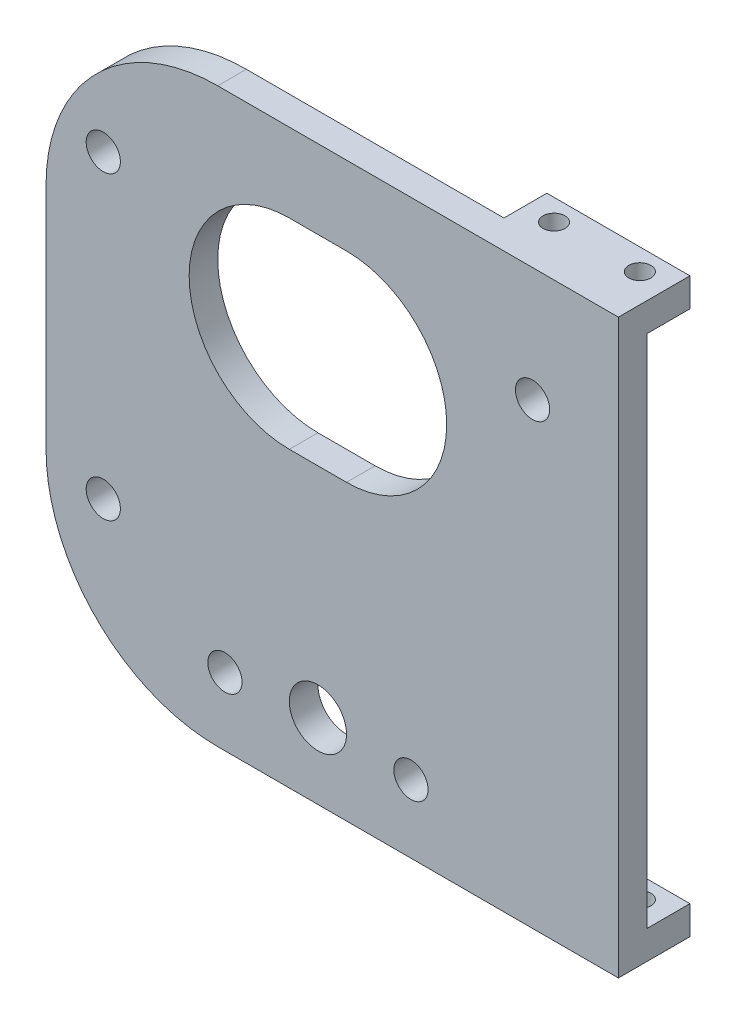
from build123d import *

# Parameters (mm, degrees)
SKETCH1_W             = 63.5
SKETCH1_H             = 63.5
BOSS_EXTRUDE1_DEPTH   = 3.175
BOSS_EXTRUDE2_DEPTH   = 4.7625
F_2_CLEARANCE_HOLE1_D = 2.4384
FILLET1_R             = 19.05
SKETCH5_W             = 15.875
SKETCH5_H             = 3.175
BOSS_EXTRUDE3_DEPTH   = 4.7625
F_2_CLEARANCE_HOLE2_D = 2.4384
BOSS_EXTRUDE4_START   = -3.175
SKETCH8_R             = 3.175
BOSS_EXTRUDE4_DEPTH   = 3.175
F_6_CLEARANCE_HOLE1_D = 3.7973
CUT_EXTRUDE1_REACH    = 47.597
SKETCH11_R            = 3.175


with BuildPart() as part:
    # Sketch1 → Boss-Extrude1 (new body)
    with BuildSketch(Plane.XY):
        Rectangle(SKETCH1_W, SKETCH1_H)
    extrude(amount=BOSS_EXTRUDE1_DEPTH)

    # Sketch2 → Boss-Extrude2 (add)
    with BuildSketch(Plane(origin=(0, 0, 0), x_dir=(-1, 0, 0), z_dir=(0, 0, -1))):
        Polygon((-25.4, -31.75), (-15.875, -31.75), (-15.875, -28.575), (-25.4, -28.575), (-31.75, -28.575), (-31.75, -31.75), align=None)
    extrude(amount=BOSS_EXTRUDE2_DEPTH)

    # #2 Clearance Hole1 (through all)
    with Locations(Plane(origin=(0, -28.575, 0), x_dir=(1, 0, 0), z_dir=(0, 1, 0))):
        with Locations((28.575, 2.38125), (19.05, 2.38125)):
            Hole(F_2_CLEARANCE_HOLE1_D / 2)

    # Fillet1
    fillet1_edges = [part.edges().sort_by_distance(p)[0] for p in [
        (-31.75, -31.75, 1.5875),
        (-31.75, 31.75, 1.5875),
    ]]
    fillet(fillet1_edges, radius=FILLET1_R)

    # Sketch5 → Boss-Extrude3 (add)
    with BuildSketch(Plane(origin=(0, 0, 0), x_dir=(-1, 0, 0), z_dir=(0, 0, -1))):
        with Locations((-23.8125, 30.1625)):
            Rectangle(SKETCH5_W, SKETCH5_H)
    extrude(amount=BOSS_EXTRUDE3_DEPTH)

    # #2 Clearance Hole2 (through all)
    with Locations(Plane(origin=(0, 28.575, 0), x_dir=(-1, 0, 0), z_dir=(0, -1, 0))):
        with Locations((-19.05, 2.38125), (-28.575, 2.38125)):
            Hole(F_2_CLEARANCE_HOLE2_D / 2)

    # Sketch8 → Boss-Extrude4 (add)
    with BuildSketch(Plane.XY.offset(3.175).offset(BOSS_EXTRUDE4_START)):
        with Locations((-25.4, 19.05)):
            Circle(SKETCH8_R)
        with Locations((-25.4, -14.2875)):
            Circle(SKETCH8_R)
        with Locations((22.225, 19.05)):
            Circle(SKETCH8_R)
        with Locations((8.73125, -24.209375)):
            Circle(SKETCH8_R)
        with Locations((-11.90625, -24.209375)):
            Circle(SKETCH8_R)
    extrude(amount=-BOSS_EXTRUDE4_DEPTH)

    # #6 Clearance Hole1 (through all)
    with Locations(Plane(origin=(0, 0, -3.175), x_dir=(-1, 0, 0), z_dir=(0, 0, -1))):
        with Locations((-22.225, 19.05), (25.4, 19.05), (25.4, -14.2875), (11.90625, -24.209375), (-8.73125, -24.209375)):
            Hole(F_6_CLEARANCE_HOLE1_D / 2)

    # Sketch11 → Cut-Extrude1 (cut, up to next)
    with BuildSketch(Plane.XY.offset(3.175), mode=Mode.PRIVATE) as cut_extrude1_sk1:
        with Locations((-1.5875, -23.415625)):
            Circle(SKETCH11_R)
    cut_extrude1_tool1 = extrude(cut_extrude1_sk1.sketch, amount=-CUT_EXTRUDE1_REACH, mode=Mode.PRIVATE) & part.part
    # Sketch11 → Cut-Extrude1 (cut, up to next)
    with BuildSketch(Plane.XY.offset(3.175), mode=Mode.PRIVATE) as cut_extrude1_sk2:
        with BuildLine():
            Line((-4.7625, 23.01875), (1.5875, 23.01875))
            ThreePointArc((1.5875, 23.01875), (12.7, 11.90625), (1.5875, 0.79375))
            Line((1.5875, 0.79375), (-4.7625, 0.79375))
            ThreePointArc((-4.7625, 0.79375), (-15.875, 11.90625), (-4.7625, 23.01875))
        make_face()
    cut_extrude1_tool2 = extrude(cut_extrude1_sk2.sketch, amount=-CUT_EXTRUDE1_REACH, mode=Mode.PRIVATE) & part.part
    add(cut_extrude1_tool1.solids().sort_by_distance((-1.5875, -23.415625, 3.175))[0], mode=Mode.SUBTRACT)
    add(cut_extrude1_tool2.solids().sort_by_distance((-1.5875, 11.90625, 3.175))[0], mode=Mode.SUBTRACT)


solid = part.part
